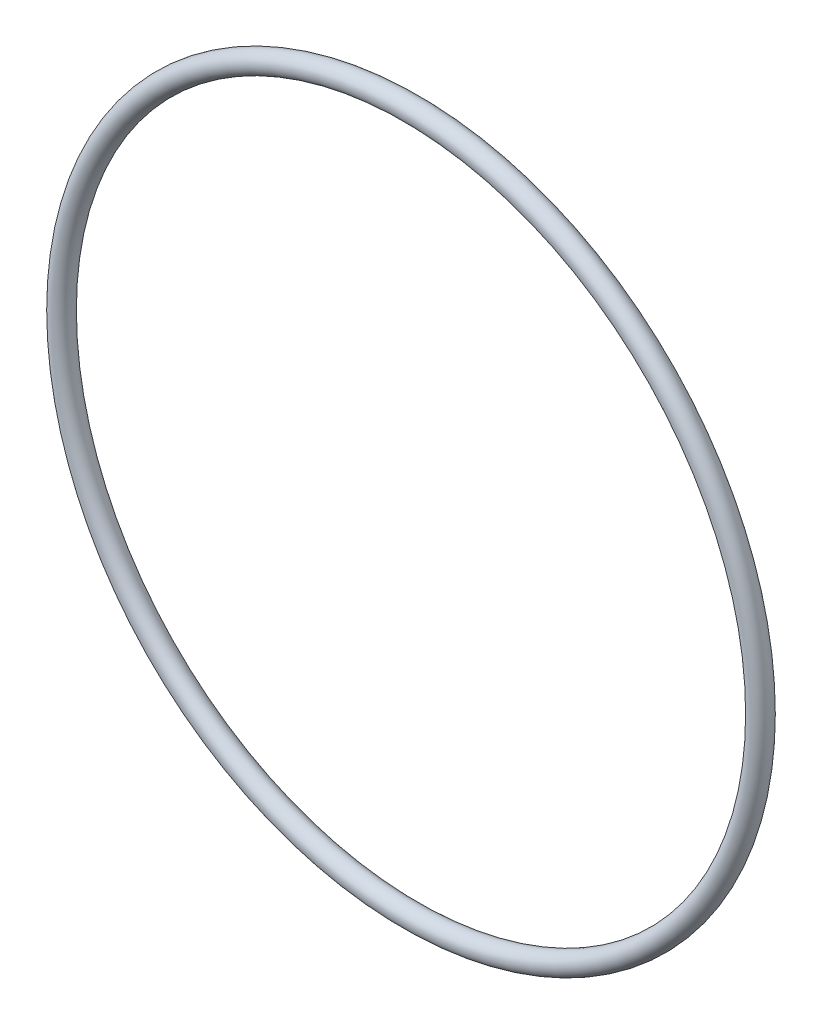
from build123d import *

# Parameters (mm, degrees)
SKETCH1_R = 1.7653


with BuildPart() as part:
    # Sketch1 → Revolve1 (revolve)
    with BuildSketch(Plane(origin=(0, 0, 0), x_dir=(0, -1, 0), z_dir=(1, 0, 0)), mode=Mode.PRIVATE) as revolve1_sk:
        with Locations((58.7121, 0)):
            Circle(SKETCH1_R)
    revolve(revolve1_sk.sketch.rotate(Axis((0, 0, 1.7653), (0, 0, -1)), 270), axis=Axis((0, 0, 1.7653), (0, 0, -1)))


solid = part.part
